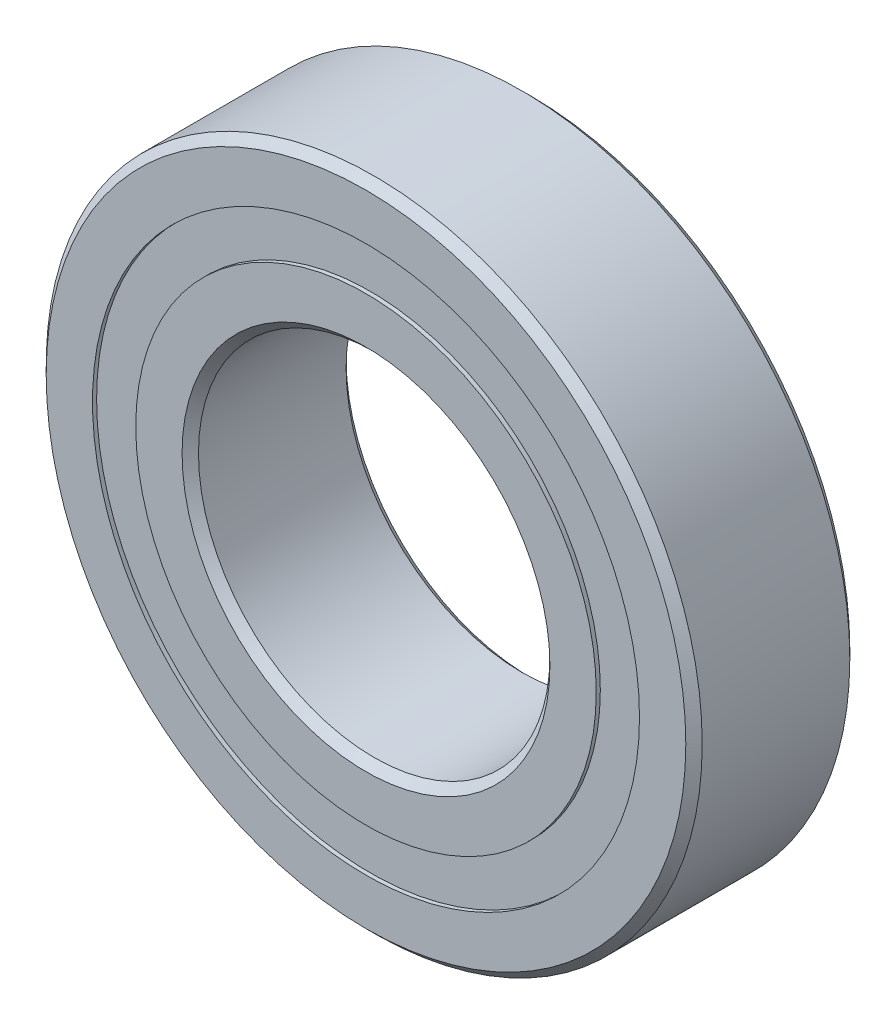
from build123d import *

# Parameters (mm, degrees)
CIRPATTERN1_COUNT = 12
SKETCH5_W         = 1.516182
SKETCH5_H         = 1.846154


with BuildPart() as part:
    # Sketch6 → Revolve1 (revolve)
    with BuildSketch(Plane(origin=(0, 0, 0), x_dir=(0, 0, -1), z_dir=(1, 0, 0))):
        with BuildLine():
            Line((-3.5, 13.65), (-3.5, 11.673077))
            Line((-3.5, 11.673077), (-1.555556, 11.673077))
            ThreePointArc((-1.555556, 11.673077), (0, 12.558818), (1.555556, 11.673077))
            Line((1.555556, 11.673077), (3.5, 11.673077))
            Line((3.5, 11.673077), (3.5, 13.65))
            Line((3.5, 13.65), (3.15, 14))
            Line((3.15, 14), (-3.15, 14))
            Line((-3.15, 14), (-3.5, 13.65))
        make_face()
        with BuildLine():
            Line((-3.5, 7.85), (-3.5, 9.826923))
            Line((-3.5, 9.826923), (-1.555556, 9.826923))
            ThreePointArc((-1.555556, 9.826923), (0, 8.941182), (1.555556, 9.826923))
            Line((1.555556, 9.826923), (3.5, 9.826923))
            Line((3.5, 9.826923), (3.5, 7.85))
            Line((3.5, 7.85), (3.15, 7.5))
            Line((3.15, 7.5), (-3.15, 7.5))
            Line((-3.15, 7.5), (-3.5, 7.85))
        make_face()
    revolve(axis=Axis((0, 0, 3.5), (0, 0, -1)))



with BuildPart() as body_2:
    # Sketch4 → Revolve2 (revolve)
    with BuildSketch(Plane(origin=(0, 0, 0), x_dir=(0, 0, -1), z_dir=(1, 0, 0))):
        with BuildLine():
            Line((-1.808818, 10.75), (1.808818, 10.75))
            ThreePointArc((1.808818, 10.75), (0, 12.558818), (-1.808818, 10.75))
        make_face()
    revolve(axis=Axis((0, 10.75, 1.808818), (0, 0, -1)))


with BuildPart() as cirpattern1_1:
    # CirPattern1: pattern copy
    add(body_2.part.rotate(Axis((0, 0, -3.5), (0, 0, 1)), 1 * 360 / CIRPATTERN1_COUNT))


with BuildPart() as cirpattern1_2:
    # CirPattern1: pattern copy
    add(body_2.part.rotate(Axis((0, 0, -3.5), (0, 0, 1)), 2 * 360 / CIRPATTERN1_COUNT))


with BuildPart() as cirpattern1_3:
    # CirPattern1: pattern copy
    add(body_2.part.rotate(Axis((0, 0, -3.5), (0, 0, 1)), 3 * 360 / CIRPATTERN1_COUNT))


with BuildPart() as cirpattern1_4:
    # CirPattern1: pattern copy
    add(body_2.part.rotate(Axis((0, 0, -3.5), (0, 0, 1)), 4 * 360 / CIRPATTERN1_COUNT))


with BuildPart() as cirpattern1_5:
    # CirPattern1: pattern copy
    add(body_2.part.rotate(Axis((0, 0, -3.5), (0, 0, 1)), 5 * 360 / CIRPATTERN1_COUNT))


with BuildPart() as cirpattern1_6:
    # CirPattern1: pattern copy
    add(body_2.part.rotate(Axis((0, 0, -3.5), (0, 0, 1)), 6 * 360 / CIRPATTERN1_COUNT))


with BuildPart() as cirpattern1_7:
    # CirPattern1: pattern copy
    add(body_2.part.rotate(Axis((0, 0, -3.5), (0, 0, 1)), 7 * 360 / CIRPATTERN1_COUNT))


with BuildPart() as cirpattern1_8:
    # CirPattern1: pattern copy
    add(body_2.part.rotate(Axis((0, 0, -3.5), (0, 0, 1)), 8 * 360 / CIRPATTERN1_COUNT))


with BuildPart() as cirpattern1_9:
    # CirPattern1: pattern copy
    add(body_2.part.rotate(Axis((0, 0, -3.5), (0, 0, 1)), 9 * 360 / CIRPATTERN1_COUNT))


with BuildPart() as cirpattern1_10:
    # CirPattern1: pattern copy
    add(body_2.part.rotate(Axis((0, 0, -3.5), (0, 0, 1)), 10 * 360 / CIRPATTERN1_COUNT))


with BuildPart() as cirpattern1_11:
    # CirPattern1: pattern copy
    add(body_2.part.rotate(Axis((0, 0, -3.5), (0, 0, 1)), 11 * 360 / CIRPATTERN1_COUNT))


with BuildPart() as part_1:
    add(part.part)

    add(body_2.part)  # Revolve3 merges body 2

    add(cirpattern1_1.part)  # Revolve3 merges CirPattern1_1

    add(cirpattern1_2.part)  # Revolve3 merges CirPattern1_2

    add(cirpattern1_3.part)  # Revolve3 merges CirPattern1_3

    add(cirpattern1_4.part)  # Revolve3 merges CirPattern1_4

    add(cirpattern1_5.part)  # Revolve3 merges CirPattern1_5

    add(cirpattern1_6.part)  # Revolve3 merges CirPattern1_6

    add(cirpattern1_7.part)  # Revolve3 merges CirPattern1_7

    add(cirpattern1_8.part)  # Revolve3 merges CirPattern1_8

    add(cirpattern1_9.part)  # Revolve3 merges CirPattern1_9

    add(cirpattern1_10.part)  # Revolve3 merges CirPattern1_10

    add(cirpattern1_11.part)  # Revolve3 merges CirPattern1_11
    # Sketch5 → Revolve3 (revolve)
    with BuildSketch(Plane(origin=(0, 0, 0), x_dir=(0, 0, -1), z_dir=(1, 0, 0))):
        with Locations((-2.566909, 10.75)):
            Rectangle(SKETCH5_W, SKETCH5_H)
        with Locations((2.566909, 10.75)):
            Rectangle(SKETCH5_W, SKETCH5_H)
    revolve(axis=Axis((0, 0, 3.5), (0, 0, -1)))


solid = part_1.part
